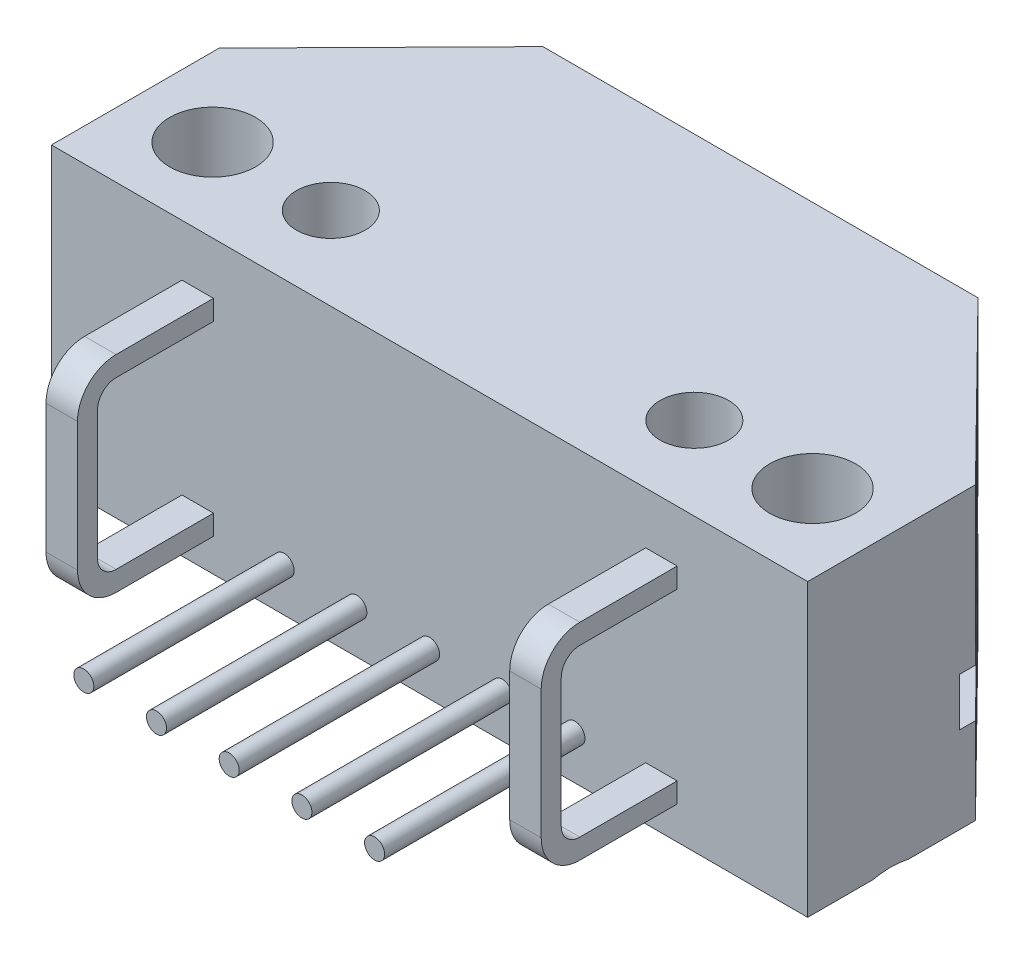
from build123d import *

# Parameters (mm, degrees)
AUFSATZ_LINEAR_AUSTRAGEN1_DEPTH                      = 6.74
AUFSATZ_LINEAR_AUSTRAGEN1_DEPTH_BACK                 = 3.42
SKIZZE1_R                                            = 1.385
SCHNITT_LINEAR_AUSTRAGEN1_DEPTH                      = 24.827593248
SCHNITT_LINEAR_AUSTRAGEN1_DEPTH_BACK                 = 24.827593248
SKIZZE2_W                                            = 16.035180953
SKIZZE2_H                                            = 1.68
SKIZZE3_R                                            = 1.2
SCHNITT_LINEAR_AUSTRAGEN2_DEPTH                      = 2.16
SKIZZE4_R                                            = 0.35
AUFSATZ_LINEAR_AUSTRAGEN2_DEPTH                      = 7
LINEAR_AUSTRAGEN_D_NN1_DEPTH                         = 0.55
FORMSENKUNG_F_R_M3_SENKSCHRAUBE_MIT_SCHL_D           = 3
FORMSENKUNG_F_R_M3_SENKSCHRAUBE_MIT_SCHL_DEPTH       = 11
FORMSENKUNG_F_R_M3_SENKSCHRAUBE_MIT_SCHL_CSINK_D     = 5.6
FORMSENKUNG_F_R_M3_SENKSCHRAUBE_MIT_SCHL_CSINK_ANGLE = 90
FORMSENKUNG_F_R_M3_SENKSCHRAUBE_MIT_SCHL_TIP         = 0.901290929


with BuildPart() as part:
    # Skizze1 → Aufsatz-Linear austragen1 (new, two sides: drawn at the far end of the back side and taken through both)
    with BuildSketch(Plane(origin=(0, 0, 0), x_dir=(1, 0, 0), z_dir=(0, 1, 0)).offset(-AUFSATZ_LINEAR_AUSTRAGEN1_DEPTH_BACK)):
        Polygon((-13.21, -18.65), (-13.21, -12.79), (-7.6, -7.09), (7.6, -7.09), (13.21, -12.79), (13.21, -18.65), align=None)
        with Locations((-10.48, -15.75)):
            Circle(SKIZZE1_R, mode=Mode.SUBTRACT)
        with Locations((10.48, -15.75)):
            Circle(SKIZZE1_R, mode=Mode.SUBTRACT)
    extrude(amount=AUFSATZ_LINEAR_AUSTRAGEN1_DEPTH + AUFSATZ_LINEAR_AUSTRAGEN1_DEPTH_BACK)

    # Skizze2 → Schnitt-Linear austragen1 (cut, two sides: drawn at the far end of the back side and taken through both)
    with BuildSketch(Plane(origin=(0, 0, 0), x_dir=(0, 0, -1), z_dir=(1, 0, 0)).offset(-SCHNITT_LINEAR_AUSTRAGEN1_DEPTH_BACK)):
        with Locations((-5.332409524, 0.44)):
            Rectangle(SKIZZE2_W, SKIZZE2_H)
    extrude(amount=SCHNITT_LINEAR_AUSTRAGEN1_DEPTH + SCHNITT_LINEAR_AUSTRAGEN1_DEPTH_BACK, mode=Mode.SUBTRACT)

    # Skizze3 → Schnitt-Linear austragen2 (cut)
    with BuildSketch(Plane(origin=(0, 6.74, 0), x_dir=(1, 0, 0), z_dir=(0, 1, 0))):
        with Locations((6.35, -15.75)):
            Circle(SKIZZE3_R)
        with Locations((-6.35, -15.75)):
            Circle(SKIZZE3_R)
    extrude(amount=-SCHNITT_LINEAR_AUSTRAGEN2_DEPTH, mode=Mode.SUBTRACT)

    # Skizze4 → Aufsatz-Linear austragen2 (add)
    with BuildSketch(Plane.XY.offset(18.65)):
        with Locations((0, -1.9)):
            Circle(SKIZZE4_R)
        with Locations((2.54, -1.9)):
            Circle(SKIZZE4_R)
        with Locations((5.08, -1.9)):
            Circle(SKIZZE4_R)
        with Locations((-2.54, -1.9)):
            Circle(SKIZZE4_R)
        with Locations((-5.08, -1.9)):
            Circle(SKIZZE4_R)
    extrude(amount=AUFSATZ_LINEAR_AUSTRAGEN2_DEPTH)

    # Skizze5 → Linear-Austragen-Dünn1 (add, symmetric)
    with BuildSketch(Plane(origin=(8.1, 0, 0), x_dir=(0, 0, -1), z_dir=(1, 0, 0))):
        with BuildLine():
            Line((-18.65, -1.57), (-22.05, -1.57))
            ThreePointArc((-22.05, -1.57), (-22.509619408, -1.379619408), (-22.7, -0.92))
            Line((-22.7, -0.92), (-22.7, 3.58))
            ThreePointArc((-22.7, 3.58), (-22.509619408, 4.039619408), (-22.05, 4.23))
            Line((-22.05, 4.23), (-18.65, 4.23))
            Line((-18.65, 4.23), (-18.65, 4.93))
            Line((-18.65, 4.93), (-22.05, 4.93))
            ThreePointArc((-22.05, 4.93), (-23.004594155, 4.534594155), (-23.4, 3.58))
            Line((-23.4, 3.58), (-23.4, -0.92))
            ThreePointArc((-23.4, -0.92), (-23.004594155, -1.874594155), (-22.05, -2.27))
            Line((-22.05, -2.27), (-18.65, -2.27))
            Line((-18.65, -2.27), (-18.65, -1.57))
        make_face()
    linear_austragen_d_nn1 = extrude(amount=LINEAR_AUSTRAGEN_D_NN1_DEPTH, both=True)

    # Spiegeln1: Linear-Austragen-Dünn1 across plane
    add(linear_austragen_d_nn1.mirror(Plane(origin=(0, 0, 0), x_dir=(0, 0, 1), z_dir=(1, 0, 0))))

    # Formsenkung für M3 Senkschraube mit Schlitz/Kreuzschlitz1
    with Locations(Plane(origin=(0, -3.42, 0), x_dir=(-1, 0, 0), z_dir=(0, -1, 0))):
        with Locations((-10.48, -15.75), (10.48, -15.75)):
            CounterSinkHole(FORMSENKUNG_F_R_M3_SENKSCHRAUBE_MIT_SCHL_D / 2, FORMSENKUNG_F_R_M3_SENKSCHRAUBE_MIT_SCHL_CSINK_D / 2, depth=FORMSENKUNG_F_R_M3_SENKSCHRAUBE_MIT_SCHL_DEPTH, counter_sink_angle=FORMSENKUNG_F_R_M3_SENKSCHRAUBE_MIT_SCHL_CSINK_ANGLE)
            with Locations((0, 0, -(FORMSENKUNG_F_R_M3_SENKSCHRAUBE_MIT_SCHL_DEPTH + FORMSENKUNG_F_R_M3_SENKSCHRAUBE_MIT_SCHL_TIP / 2))):  # 118° drill point
                Cone(0, FORMSENKUNG_F_R_M3_SENKSCHRAUBE_MIT_SCHL_D / 2, FORMSENKUNG_F_R_M3_SENKSCHRAUBE_MIT_SCHL_TIP, mode=Mode.SUBTRACT)


solid = part.part
